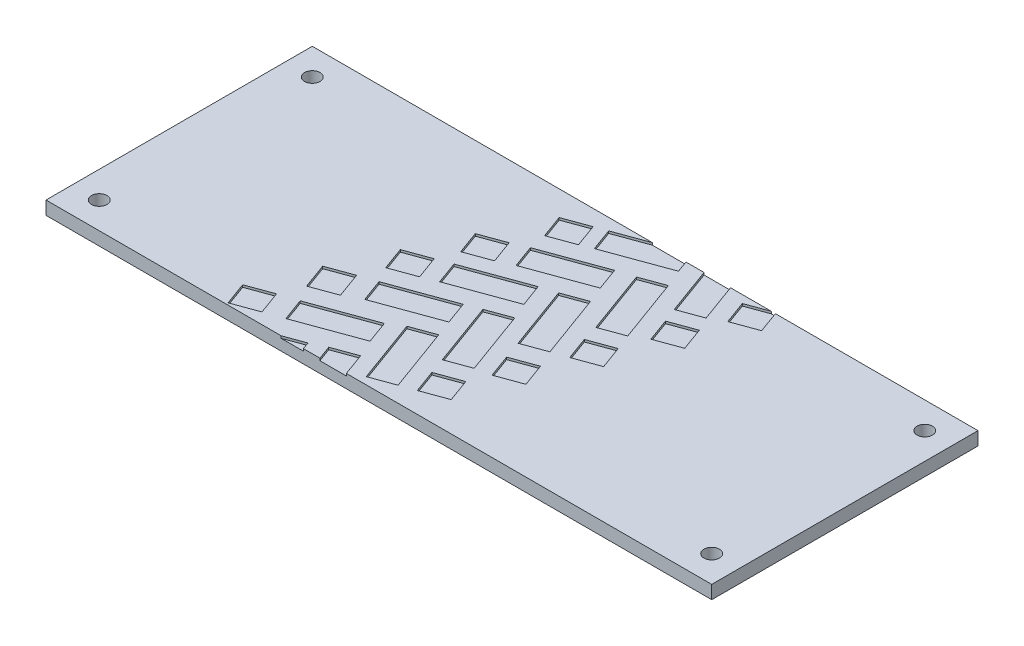
from build123d import *

# Parameters (mm, degrees)
SKETCH1_W           = 150
SKETCH1_H           = 60
BOSS_EXTRUDE1_DEPTH = 3
CUT_EXTRUDE1_REACH  = 102.604
SKETCH2_R           = 1.75
CUT_EXTRUDE2_DEPTH  = 0.5


with BuildPart() as part:
    # Sketch1 → Boss-Extrude1 (new body)
    with BuildSketch(Plane(origin=(0, 0, 0), x_dir=(1, 0, 0), z_dir=(0, 1, 0))):
        with Locations((20.614523463, 1.144067797)):
            Rectangle(SKETCH1_W, SKETCH1_H)
    extrude(amount=BOSS_EXTRUDE1_DEPTH)

    # Sketch2 → Cut-Extrude1 (cut, up to next)
    with BuildSketch(Plane(origin=(0, 3, 0), x_dir=(1, 0, 0), z_dir=(0, 1, 0)), mode=Mode.PRIVATE) as cut_extrude1_sk1:
        with Locations(Location((-48.385476537, 25.144067797, 0), (0, 0, 270))):
            Circle(SKETCH2_R)
    cut_extrude1_tool1 = extrude(cut_extrude1_sk1.sketch, amount=-CUT_EXTRUDE1_REACH, mode=Mode.PRIVATE) & part.part
    # Sketch2 → Cut-Extrude1 (cut, up to next)
    with BuildSketch(Plane(origin=(0, 3, 0), x_dir=(1, 0, 0), z_dir=(0, 1, 0)), mode=Mode.PRIVATE) as cut_extrude1_sk2:
        with Locations(Location((-48.385476537, -22.855932203, 0), (0, 0, 270))):
            Circle(SKETCH2_R)
    cut_extrude1_tool2 = extrude(cut_extrude1_sk2.sketch, amount=-CUT_EXTRUDE1_REACH, mode=Mode.PRIVATE) & part.part
    # Sketch2 → Cut-Extrude1 (cut, up to next)
    with BuildSketch(Plane(origin=(0, 3, 0), x_dir=(1, 0, 0), z_dir=(0, 1, 0)), mode=Mode.PRIVATE) as cut_extrude1_sk3:
        with Locations(Location((89.614523463, -22.855932203, 0), (0, 0, 270))):
            Circle(SKETCH2_R)
    cut_extrude1_tool3 = extrude(cut_extrude1_sk3.sketch, amount=-CUT_EXTRUDE1_REACH, mode=Mode.PRIVATE) & part.part
    # Sketch2 → Cut-Extrude1 (cut, up to next)
    with BuildSketch(Plane(origin=(0, 3, 0), x_dir=(1, 0, 0), z_dir=(0, 1, 0)), mode=Mode.PRIVATE) as cut_extrude1_sk4:
        with Locations(Location((89.614523463, 25.144067797, 0), (0, 0, 270))):
            Circle(SKETCH2_R)
    cut_extrude1_tool4 = extrude(cut_extrude1_sk4.sketch, amount=-CUT_EXTRUDE1_REACH, mode=Mode.PRIVATE) & part.part
    add(cut_extrude1_tool1.solids().sort_by_distance((-48.385477, 3, -25.144068))[0], mode=Mode.SUBTRACT)
    add(cut_extrude1_tool2.solids().sort_by_distance((-48.385477, 3, 22.855932))[0], mode=Mode.SUBTRACT)
    add(cut_extrude1_tool3.solids().sort_by_distance((89.614523, 3, 22.855932))[0], mode=Mode.SUBTRACT)
    add(cut_extrude1_tool4.solids().sort_by_distance((89.614523, 3, -25.144068))[0], mode=Mode.SUBTRACT)

    # Sketch4 → Cut-Extrude2 (cut)
    with BuildSketch(Plane(origin=(0, 3, 0), x_dir=(1, 0, 0), z_dir=(0, 1, 0))):
        Polygon((-4.791426937, 1.38027169), (-2.904268689, -3.78923879), (2.69009548, -1.746985365), (0.802937232, 3.422525114), align=None)
        Polygon((4.072217559, 4.615993888), (17.963708333, 9.687159037), (19.814965077, 4.615993888), (5.923474302, -0.455171261), align=None)
        Polygon((0.537631953, 12.942669892), (2.424790201, 7.773159413), (8.01915437, 9.815412837), (6.131996122, 14.984923317), align=None)
        Polygon((6.855118637, 25.534649861), (8.742276884, 20.365139381), (14.336641053, 22.407392806), (12.449482806, 27.576903285), align=None)
        Polygon((-10.303537871, -10.596668593), (-8.222494664, -16.297289982), (-2.628130495, -14.255036558), (-4.709173702, -8.554415169), align=None)
        Polygon((22.734653732, -19.026845993), (24.621811979, -24.196356472), (30.216176149, -22.154103048), (28.329017901, -16.984592568), align=None)
        Polygon((28.15962548, -7.617265398), (30.046783727, -12.786775877), (35.641147896, -10.744522452), (33.753989649, -5.575011973), align=None)
        Polygon((33.470482261, 4.581220115), (35.357640508, -0.588290364), (40.952004677, 1.453963061), (39.06484643, 6.62347354), align=None)
        Polygon((39.033241178, 17.298759053), (40.920399425, 12.129248573), (46.514763594, 14.171501998), (44.627605347, 19.341012477), align=None)
        Polygon((44.260137656, 29.397485637), (46.147295903, 24.227975157), (51.741660072, 26.270228582), (49.854501825, 31.439739061), align=None)
        Polygon((-15.693454614, -23.238088767), (-13.806296367, -28.407599247), (-8.211932198, -26.365345822), (-10.099090445, -21.195835343), align=None)
        Polygon((-0.93033458, -7.272900817), (12.961156194, -2.201735668), (14.812412937, -7.272900817), (0.920922163, -12.344065966), align=None)
        Polygon((-6.074509675, -19.891339922), (7.816981099, -14.820174773), (9.668237843, -19.891339922), (-4.223252932, -24.962505072), align=None)
        Polygon((9.497387621, 16.409742117), (23.388878396, 21.480907266), (25.240135139, 16.409742117), (11.348644365, 11.338576968), align=None)
        Polygon((15.029728795, 28.514461172), (28.921219569, 33.585626321), (30.772476312, 28.514461172), (16.880985538, 23.443296023), align=None)
        Polygon((-10.862556564, -32.312872197), (3.028934211, -27.241707048), (4.880190954, -32.312872197), (-9.011299821, -37.384037346), align=None)
        Polygon((16.161463862, -27.241707048), (21.421250331, -25.321593054), (16.161463862, -10.913410108), (10.901677392, -12.833524103), align=None)
        Polygon((11.452927675, -40.137517662), (16.712714145, -38.217403668), (11.452927675, -23.809220723), (6.193141206, -25.729334717), align=None)
        Polygon((21.432742799, -15.374475147), (26.692529268, -13.454361153), (21.432742799, 0.953821792), (16.172956329, -0.966292202), align=None)
        Polygon((26.748696994, -3.629622604), (32.008483463, -1.70950861), (26.748696994, 12.698674336), (21.488910524, 10.778560341), align=None)
        Polygon((32.423035231, 8.232679073), (37.6828217, 10.152793068), (32.423035231, 24.560976013), (27.163248761, 22.640862019), align=None)
        Polygon((37.754362659, 20.558284805), (43.014149128, 22.4783988), (37.754362659, 36.886581745), (32.494576189, 34.966467751), align=None)
    extrude(amount=-CUT_EXTRUDE2_DEPTH, mode=Mode.SUBTRACT)


solid = part.part
